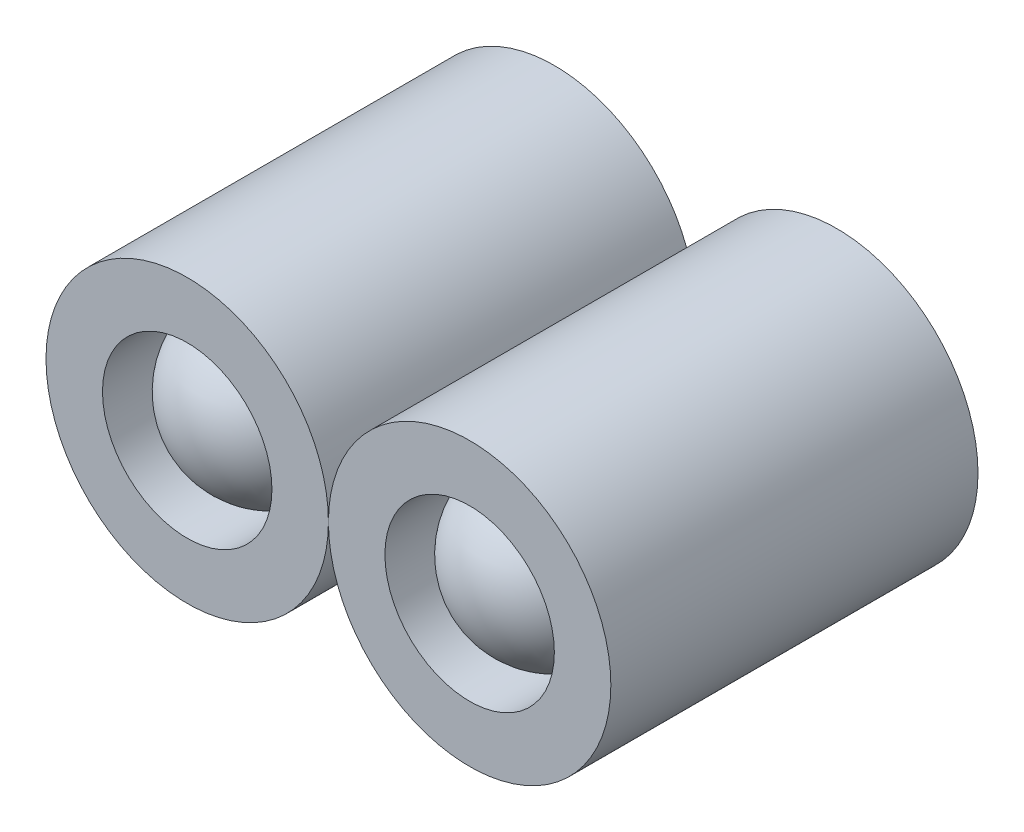
from build123d import *

# Parameters (mm, degrees)
SKETCH_1_R      = 2.5
SKETCH_1_R_2    = 1.5
EXTRUDE_1_DEPTH = 6.5
SKETCH_2_R      = 2.5
SKETCH_2_R_2    = 1.5
EXTRUDE_2_DEPTH = 6.5
SKETCH_3_R      = 1.5
EXTRUDE_3_DEPTH = 5


with BuildPart() as part:
    # 草图1 → 凸台-拉伸1 (new body)
    with BuildSketch(Plane.XY):
        with Locations(Location((-22.433647208, 17.449673572, 0), (0, 0, 180))):
            Circle(SKETCH_1_R)
        with Locations(Location((-22.433647208, 17.449673572, 0), (0, 0, 180))):
            Circle(SKETCH_1_R_2, mode=Mode.SUBTRACT)
    extrude(amount=EXTRUDE_1_DEPTH)



with BuildPart() as body_2:
    # 草图2 → 凸台-拉伸2 (new body)
    with BuildSketch(Plane.XY):
        with Locations(Location((-17.433647208, 17.449673572, 0), (0, 0, 180))):
            Circle(SKETCH_2_R)
        with Locations(Location((-17.433647208, 17.449673572, 0), (0, 0, 180))):
            Circle(SKETCH_2_R_2, mode=Mode.SUBTRACT)
    extrude(amount=EXTRUDE_2_DEPTH)


with BuildPart() as part_1:
    add(part.part)

    add(body_2.part)  # 凸台-拉伸3 merges body 2
    # 草图3 → 凸台-拉伸3 (add)
    with BuildSketch(Plane.XY):
        with Locations(Location((-22.433647208, 17.449673572, 0), (0, 0, 180))):
            Circle(SKETCH_3_R)
        with Locations(Location((-17.433647208, 17.449673572, 0), (0, 0, 180))):
            Circle(SKETCH_3_R)
    extrude(amount=EXTRUDE_3_DEPTH)


with BuildPart() as body_2_2:
    # 草图4 → 旋转1 (revolve)
    with BuildSketch(Plane.XY.offset(5)):
        with BuildLine():
            Line((-22.433647208, 18.949673572), (-22.433647208, 15.949673572))
            ThreePointArc((-22.433647208, 15.949673572), (-20.933647208, 17.449673572), (-22.433647208, 18.949673572))
        make_face()
    revolve(axis=Axis((-22.433647208, 18.949673572, 5), (0, -1, 0)))


with BuildPart() as body_3:
    # 草图5 → 旋转2 (revolve)
    with BuildSketch(Plane.XY.offset(5)):
        with BuildLine():
            Line((-17.433647208, 18.949673572), (-17.433647208, 15.949673572))
            ThreePointArc((-17.433647208, 15.949673572), (-15.933647208, 17.449673572), (-17.433647208, 18.949673572))
        make_face()
    revolve(axis=Axis((-17.433647208, 18.949673572, 5), (0, -1, 0)))


solid = Compound([part_1.part, body_2_2.part, body_3.part])
